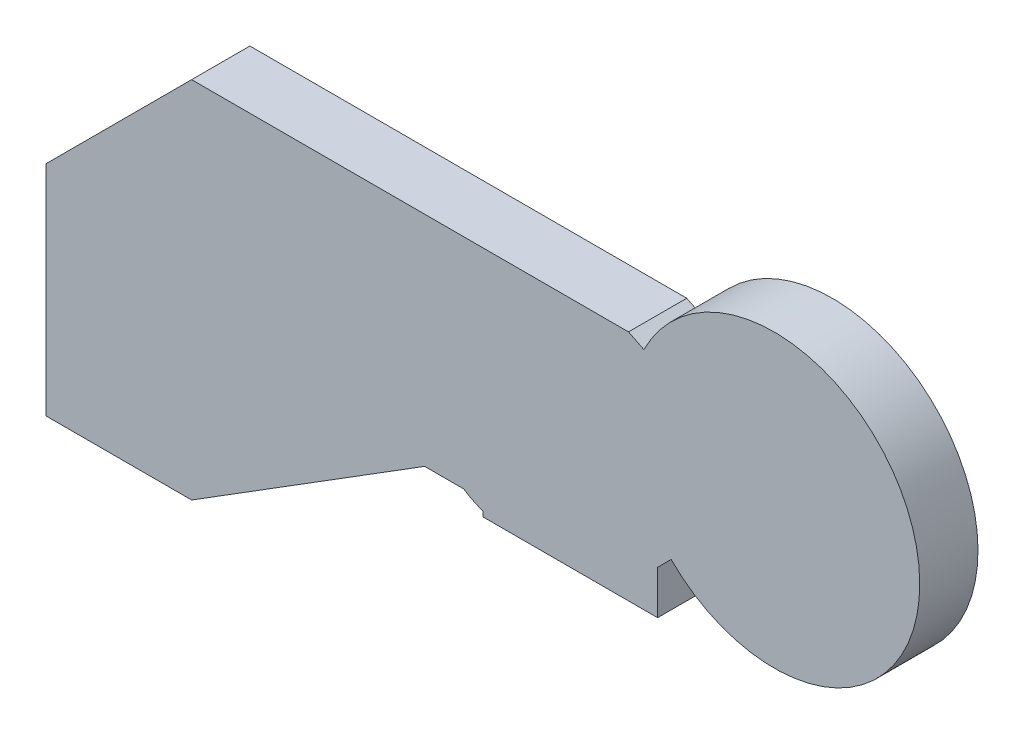
from build123d import *

# Parameters (mm, degrees)
BOSS_EXTRUDE1_DEPTH = 4
SKETCH2_R           = 10
BOSS_EXTRUDE2_DEPTH = 4
SKETCH6_R           = 6
BOSS_EXTRUDE3_DEPTH = 4
SKETCH9_W           = 12
SKETCH9_H           = 12
BOSS_EXTRUDE4_DEPTH = 4


with BuildPart() as part:
    # Sketch1 → Boss-Extrude1 (new body)
    with BuildSketch(Plane.XY):
        Polygon((0, -10), (10, -10), (26, 0), (40, 0), (50, 10), (40, 15), (10, 15), (0, 5), align=None)
    extrude(amount=BOSS_EXTRUDE1_DEPTH)

    # Sketch2 → Boss-Extrude2 (add)
    with BuildSketch(Plane.XY):
        with Locations((50, 10)):
            Circle(SKETCH2_R)
    extrude(amount=BOSS_EXTRUDE2_DEPTH)

    # Sketch6 → Boss-Extrude3 (add)
    with BuildSketch(Plane.XY):
        with Locations((32, 5)):
            Circle(SKETCH6_R)
    extrude(amount=BOSS_EXTRUDE3_DEPTH)

    # Sketch9 → Boss-Extrude4 (add)
    with BuildSketch(Plane.XY):
        with Locations((36, 5)):
            Rectangle(SKETCH9_W, SKETCH9_H)
    extrude(amount=BOSS_EXTRUDE4_DEPTH)


solid = part.part
